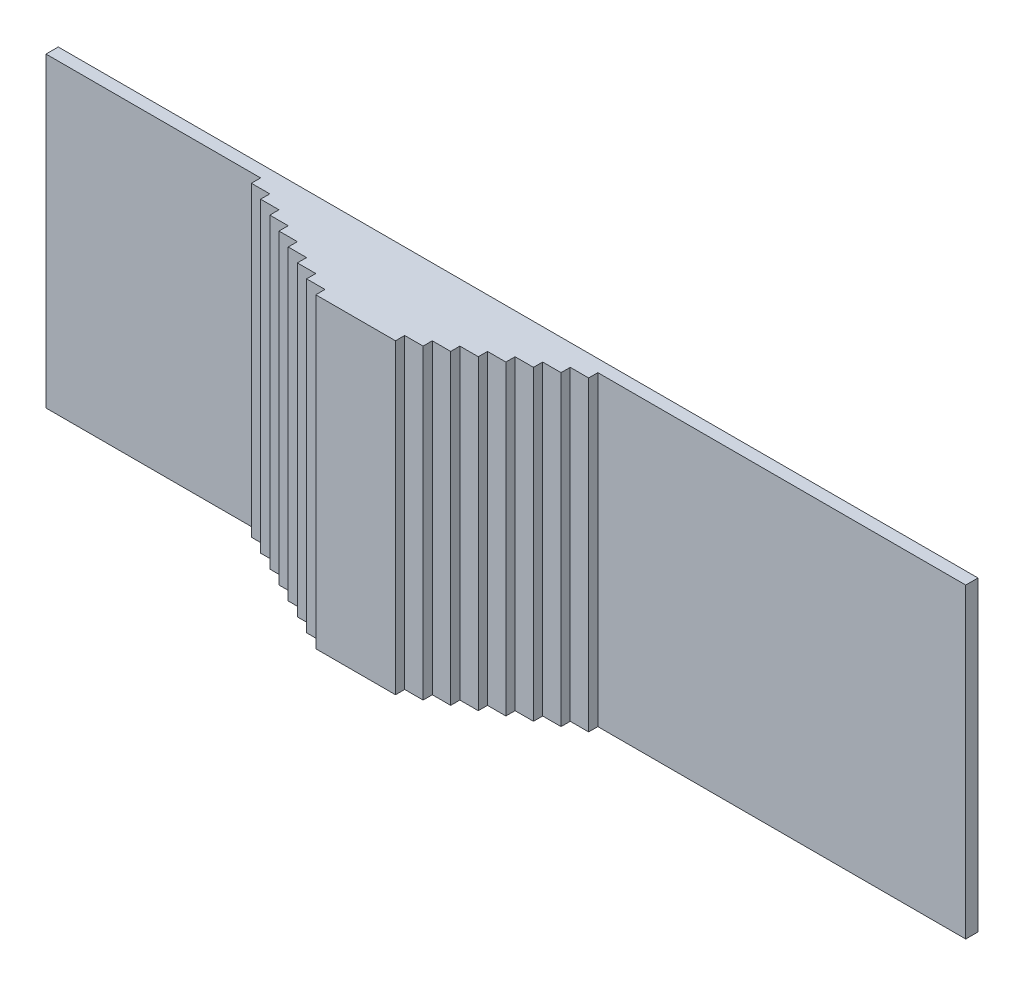
from build123d import *

# Parameters (mm, degrees)
SKETCH3_W           = 15000
SKETCH3_H           = 5000
BOSS_EXTRUDE1_DEPTH = 200
SKETCH4_W           = 300
SKETCH4_H           = 5000
STEP1_DEPTH         = 150
SKETCH4_4_W         = 300
SKETCH4_4_H         = 5000
STEP2_DEPTH         = 300
SKETCH4_5_W         = 300
SKETCH4_5_H         = 5000
STEP3_DEPTH         = 450
SKETCH4_6_W         = 300
SKETCH4_6_H         = 5000
STEP4_DEPTH         = 600
SKETCH4_7_W         = 300
SKETCH4_7_H         = 5000
STEP5_DEPTH         = 750
SKETCH4_8_W         = 300
SKETCH4_8_H         = 5000
STEP6_DEPTH         = 900
SKETCH4_9_W         = 300
SKETCH4_9_H         = 5000
STEP7_DEPTH         = 1050
SKETCH4_10_W        = 300
SKETCH4_10_H        = 5000
STEP8_DEPTH         = 1200
SKETCH9_W           = 1000
SKETCH9_H           = 5000
BOSS_EXTRUDE2_DEPTH = 1200
SKETCH10_W          = 300
SKETCH10_H          = 5000
BOSS_EXTRUDE3_DEPTH = 1050
SKETCH10_3_W        = 300
SKETCH10_3_H        = 5000
BOSS_EXTRUDE4_DEPTH = 900
SKETCH10_4_W        = 300
SKETCH10_4_H        = 5000
BOSS_EXTRUDE5_DEPTH = 750
SKETCH10_5_W        = 300
SKETCH10_5_H        = 5000
BOSS_EXTRUDE6_DEPTH = 600
SKETCH10_6_W        = 300
SKETCH10_6_H        = 5000
BOSS_EXTRUDE7_DEPTH = 450
SKETCH10_7_W        = 300
SKETCH10_7_H        = 5000
BOSS_EXTRUDE8_DEPTH = 300
SKETCH10_8_W        = 300
SKETCH10_8_H        = 5000
BOSS_EXTRUDE9_DEPTH = 150


with BuildPart() as part:
    # Sketch3 → Boss-Extrude1 (new body)
    with BuildSketch(Plane.XY):
        with Locations((5000, 0)):
            Rectangle(SKETCH3_W, SKETCH3_H)
    extrude(amount=BOSS_EXTRUDE1_DEPTH)

    # Sketch4 → Step1 (add)
    with BuildSketch(Plane.XY.offset(200)):
        with Locations((1150, 0)):
            Rectangle(SKETCH4_W, SKETCH4_H)
    extrude(amount=STEP1_DEPTH)

    # Sketch4<4> → Step2 (add)
    with BuildSketch(Plane.XY.offset(200)):
        with Locations((1450, 0)):
            Rectangle(SKETCH4_4_W, SKETCH4_4_H)
    extrude(amount=STEP2_DEPTH)

    # Sketch4<5> → Step3 (add)
    with BuildSketch(Plane.XY.offset(200)):
        with Locations((1750, 0)):
            Rectangle(SKETCH4_5_W, SKETCH4_5_H)
    extrude(amount=STEP3_DEPTH)

    # Sketch4<6> → Step4 (add)
    with BuildSketch(Plane.XY.offset(200)):
        with Locations((2050, 0)):
            Rectangle(SKETCH4_6_W, SKETCH4_6_H)
    extrude(amount=STEP4_DEPTH)

    # Sketch4<7> → Step5 (add)
    with BuildSketch(Plane.XY.offset(200)):
        with Locations((2350, 0)):
            Rectangle(SKETCH4_7_W, SKETCH4_7_H)
    extrude(amount=STEP5_DEPTH)

    # Sketch4<8> → Step6 (add)
    with BuildSketch(Plane.XY.offset(200)):
        with Locations((2650, 0)):
            Rectangle(SKETCH4_8_W, SKETCH4_8_H)
    extrude(amount=STEP6_DEPTH)

    # Sketch4<9> → Step7 (add)
    with BuildSketch(Plane.XY.offset(200)):
        with Locations((2950, 0)):
            Rectangle(SKETCH4_9_W, SKETCH4_9_H)
    extrude(amount=STEP7_DEPTH)

    # Sketch4<10> → Step8 (add)
    with BuildSketch(Plane.XY.offset(200)):
        with Locations((3250, 0)):
            Rectangle(SKETCH4_10_W, SKETCH4_10_H)
    extrude(amount=STEP8_DEPTH)

    # Sketch9 → Boss-Extrude2 (add)
    with BuildSketch(Plane.XY.offset(200)):
        with Locations((3900, 0)):
            Rectangle(SKETCH9_W, SKETCH9_H)
    extrude(amount=BOSS_EXTRUDE2_DEPTH)

    # Sketch10 → Boss-Extrude3 (add)
    with BuildSketch(Plane.XY.offset(200)):
        with Locations((4550, 0)):
            Rectangle(SKETCH10_W, SKETCH10_H)
    extrude(amount=BOSS_EXTRUDE3_DEPTH)

    # Sketch10<3> → Boss-Extrude4 (add)
    with BuildSketch(Plane.XY.offset(200)):
        with Locations((4850, 0)):
            Rectangle(SKETCH10_3_W, SKETCH10_3_H)
    extrude(amount=BOSS_EXTRUDE4_DEPTH)

    # Sketch10<4> → Boss-Extrude5 (add)
    with BuildSketch(Plane.XY.offset(200)):
        with Locations((5150, 0)):
            Rectangle(SKETCH10_4_W, SKETCH10_4_H)
    extrude(amount=BOSS_EXTRUDE5_DEPTH)

    # Sketch10<5> → Boss-Extrude6 (add)
    with BuildSketch(Plane.XY.offset(200)):
        with Locations((5450, 0)):
            Rectangle(SKETCH10_5_W, SKETCH10_5_H)
    extrude(amount=BOSS_EXTRUDE6_DEPTH)

    # Sketch10<6> → Boss-Extrude7 (add)
    with BuildSketch(Plane.XY.offset(200)):
        with Locations((5750, 0)):
            Rectangle(SKETCH10_6_W, SKETCH10_6_H)
    extrude(amount=BOSS_EXTRUDE7_DEPTH)

    # Sketch10<7> → Boss-Extrude8 (add)
    with BuildSketch(Plane.XY.offset(200)):
        with Locations((6050, 0)):
            Rectangle(SKETCH10_7_W, SKETCH10_7_H)
    extrude(amount=BOSS_EXTRUDE8_DEPTH)

    # Sketch10<8> → Boss-Extrude9 (add)
    with BuildSketch(Plane.XY.offset(200)):
        with Locations((6350, 0)):
            Rectangle(SKETCH10_8_W, SKETCH10_8_H)
    extrude(amount=BOSS_EXTRUDE9_DEPTH)


solid = part.part
